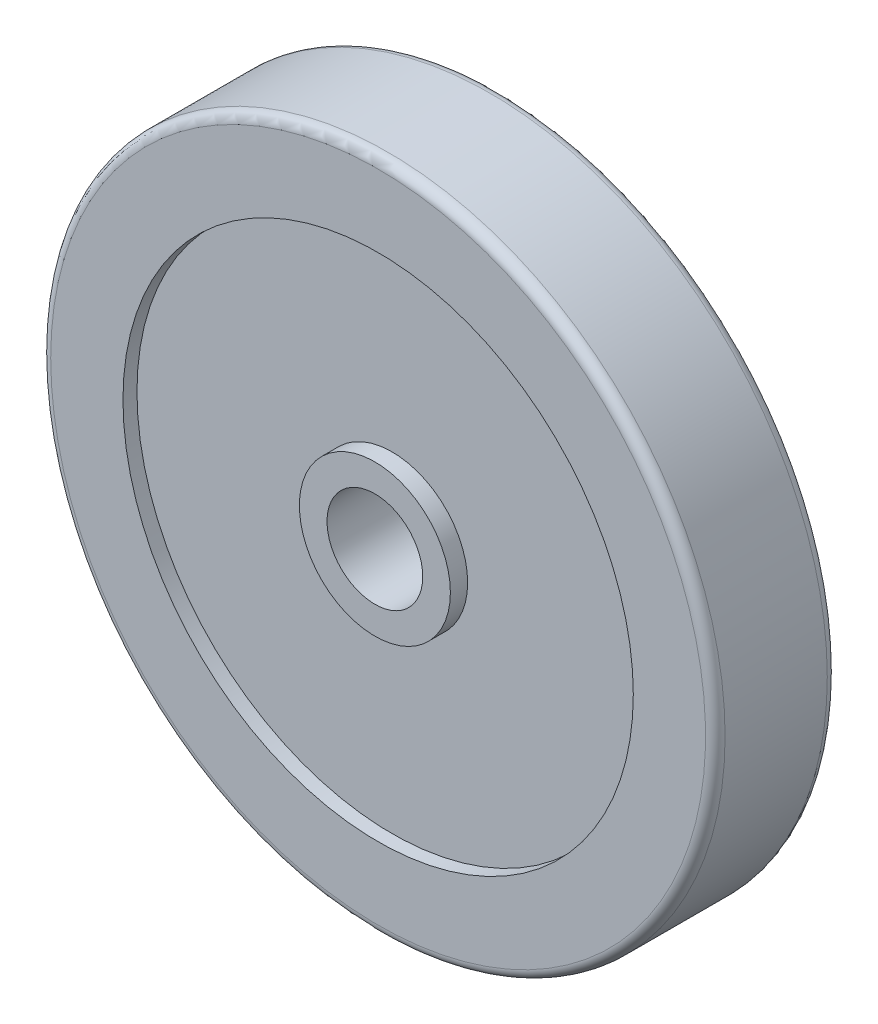
from build123d import *

# Parameters (mm, degrees)
SKETCH1_W = 15
SKETCH1_H = 75.965253598
FILLET1_R = 3


with BuildPart() as part:
    # Sketch1 → Revolve1 (revolve)
    with BuildSketch(Plane(origin=(0, 0, 0), x_dir=(0, 0, -1), z_dir=(1, 0, 0)), mode=Mode.PRIVATE) as revolve1_sk:
        Polygon((19.7, 14.7), (-19.7, 14.7), (-19.7, 23.2), (-14.4, 23.2), (-14.4, 78.4), (-18.7, 78.4), (-18.7, 103.6), (18.7, 103.6), (18.7, 78.4), (14.4, 78.4), (14.4, 23.2), (19.7, 23.2), align=None)
        with Locations((0, 60.876891385)):
            Rectangle(SKETCH1_W, SKETCH1_H, mode=Mode.SUBTRACT)
    revolve(revolve1_sk.sketch.rotate(Axis((0, 0, 15.387931034), (0, 0, -1)), 90), axis=Axis((0, 0, 15.387931034), (0, 0, -1)))

    # Fillet1
    fillet1_edges = [part.edges().sort_by_distance(p)[0] for p in [
        (-103.6, 0, -18.7),
        (-103.6, 0, 18.7),
    ]]
    fillet(fillet1_edges, radius=FILLET1_R)


solid = part.part
